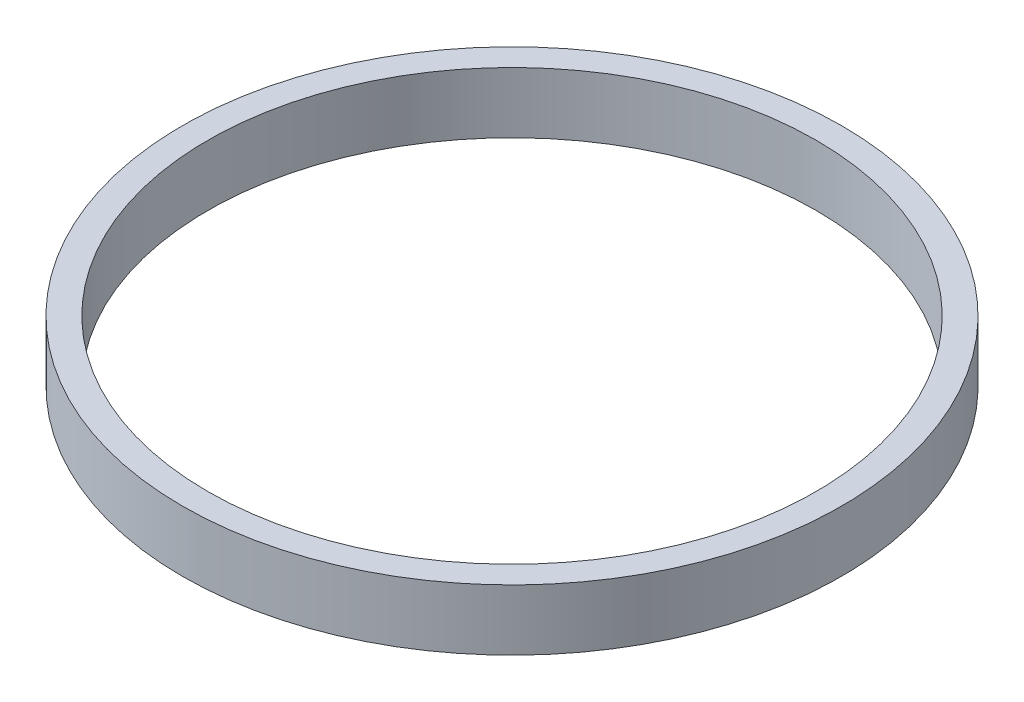
from build123d import *

# Parameters (mm, degrees)
SKETCH1_R           = 32.5
SKETCH1_R_2         = 30
BOSS_EXTRUDE1_DEPTH = 3


with BuildPart() as part:
    # Sketch1 → Boss-Extrude1 (new, symmetric)
    with BuildSketch(Plane(origin=(0, 0, 0), x_dir=(1, 0, 0), z_dir=(0, 1, 0))):
        with Locations(Location((0, 0, 0), (0, 0, 270))):
            Circle(SKETCH1_R)
        with Locations(Location((0, 0, 0), (0, 0, 270))):
            Circle(SKETCH1_R_2, mode=Mode.SUBTRACT)
    extrude(amount=BOSS_EXTRUDE1_DEPTH, both=True)


solid = part.part
